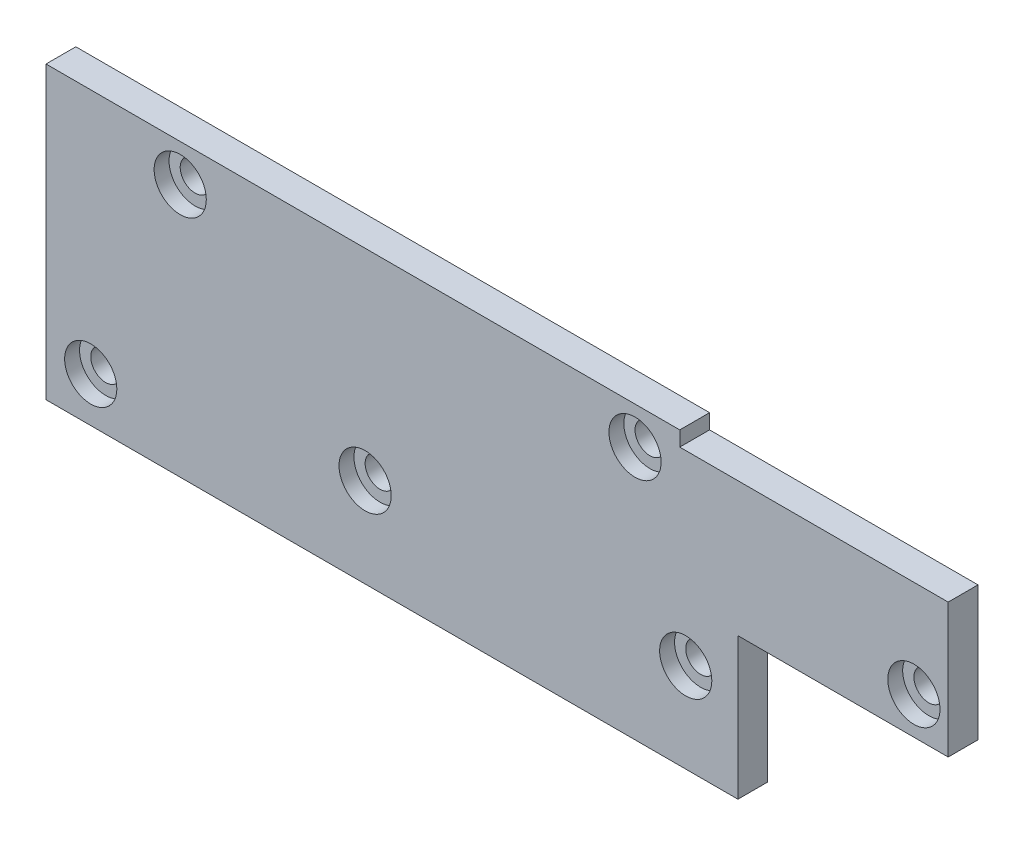
from build123d import *

# Parameters (mm, degrees)
SKETCH_1_R          = 1
EXTRUDE_1_DEPTH     = 2
CUT_EXTRUDE_START   = 1
SKETCH_1_8_R        = 1.75
SKETCH_1_8_R_2      = 1
CUT_EXTRUDE_2_DEPTH = 1


with BuildPart() as part:
    # 草图1 → 凸台-拉伸1 (new body)
    with BuildSketch(Plane.XY):
        Polygon((36.5, 0), (-6, 0), (-6, -19.5), (40.4, -19.5), (40.4, -10), (54.5, -10), (54.5, -1), (36.5, -1), align=None)
        with Locations((36.9, -13.5)):
            Circle(SKETCH_1_R, mode=Mode.SUBTRACT)
        with Locations((3, -2.5)):
            Circle(SKETCH_1_R, mode=Mode.SUBTRACT)
        with Locations((33.5, -2.5)):
            Circle(SKETCH_1_R, mode=Mode.SUBTRACT)
        with Locations((-3, -16.5)):
            Circle(SKETCH_1_R, mode=Mode.SUBTRACT)
        with Locations((15.4, -13.5)):
            Circle(SKETCH_1_R, mode=Mode.SUBTRACT)
        with Locations((52.2, -7.5)):
            Circle(SKETCH_1_R, mode=Mode.SUBTRACT)
    extrude(amount=EXTRUDE_1_DEPTH)

    # 草图1<8> → 切除-拉伸2 (cut)
    # profile 1 of 6: a face of its own
    with BuildSketch(Plane.XY.offset(CUT_EXTRUDE_START)):
        with Locations((52.2, -7.5)):
            Circle(SKETCH_1_8_R)
        with Locations((52.2, -7.5)):
            Circle(SKETCH_1_8_R_2, mode=Mode.SUBTRACT)
    # profile 2 of 6: a face of its own
    with BuildSketch(Plane.XY.offset(CUT_EXTRUDE_START)):
        with Locations((3, -2.5)):
            Circle(SKETCH_1_8_R)
    # profile 3 of 6: a face of its own
    with BuildSketch(Plane.XY.offset(CUT_EXTRUDE_START)):
        with Locations((33.5, -2.5)):
            Circle(SKETCH_1_8_R)
    # profile 4 of 6: a face of its own
    with BuildSketch(Plane.XY.offset(CUT_EXTRUDE_START)):
        with Locations((-3, -16.5)):
            Circle(SKETCH_1_8_R)
    # profile 5 of 6: a face of its own
    with BuildSketch(Plane.XY.offset(CUT_EXTRUDE_START)):
        with Locations((15.4, -13.5)):
            Circle(SKETCH_1_8_R)
    # profile 6 of 6: a face of its own
    with BuildSketch(Plane.XY.offset(CUT_EXTRUDE_START)):
        with Locations((36.9, -13.5)):
            Circle(SKETCH_1_8_R)
    extrude(amount=CUT_EXTRUDE_2_DEPTH, mode=Mode.SUBTRACT)


solid = part.part
